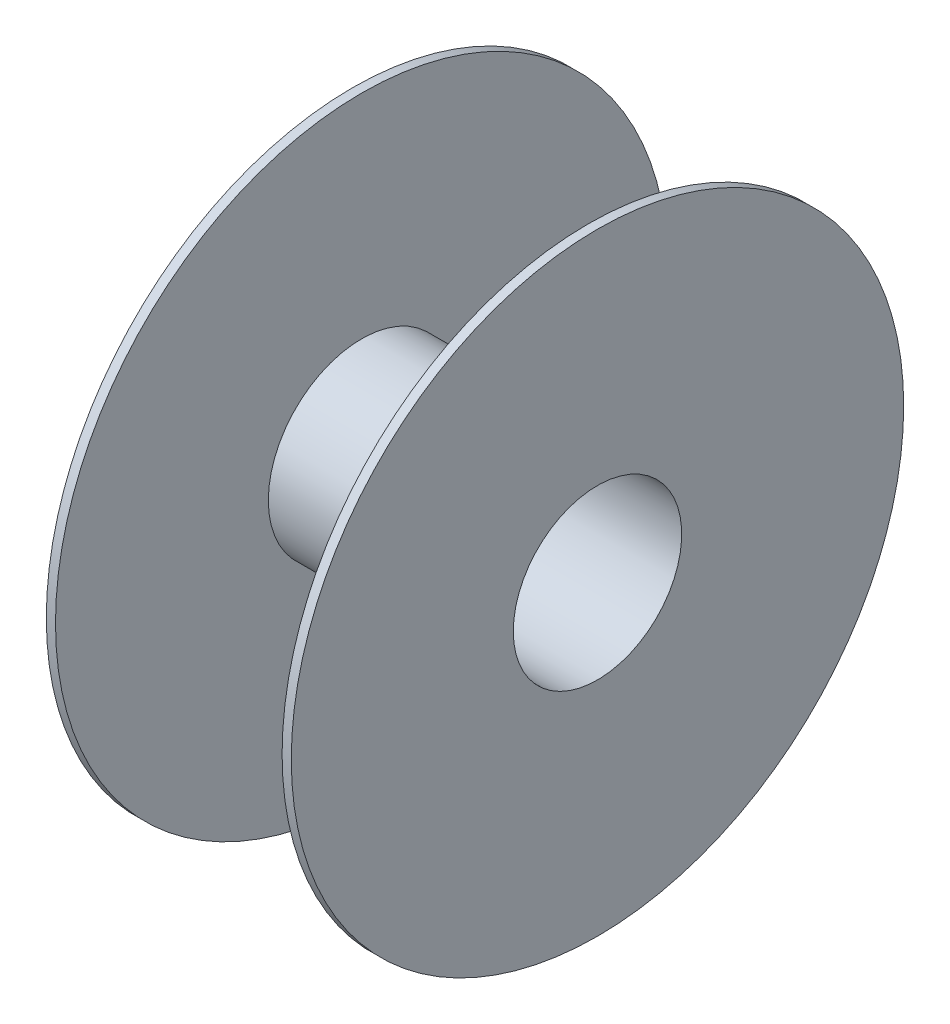
from build123d import *


with BuildPart() as part:
    # Sketch1 → Revolve1 (revolve)
    with BuildSketch(Plane.XY, mode=Mode.PRIVATE) as revolve1_sk:
        Polygon((37, 30.5), (-37, 30.5), (-37, 100), (-40, 100), (-40, 27.5), (40, 27.5), (40, 100), (37, 100), align=None)
    revolve(revolve1_sk.sketch.rotate(Axis((-40, 0, 0), (1, 0, 0)), 90), axis=Axis((-40, 0, 0), (1, 0, 0)))


solid = part.part
